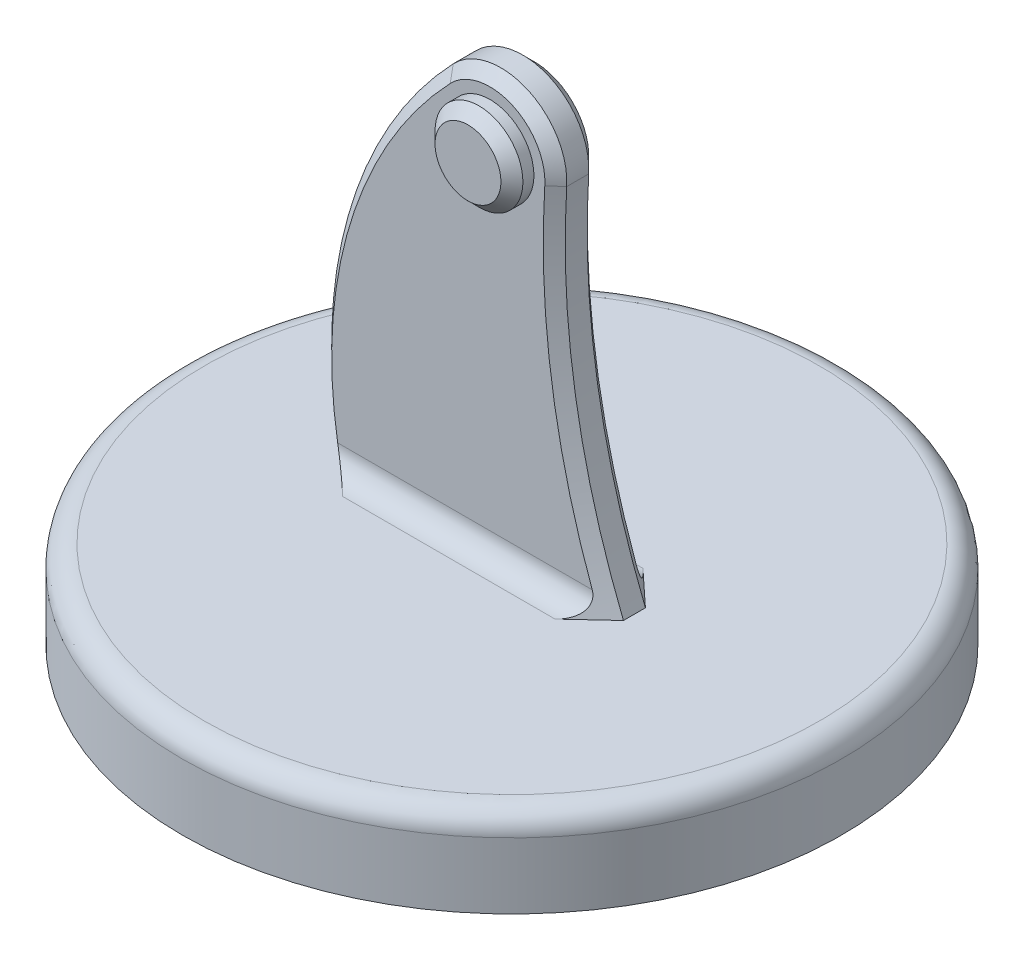
from build123d import *

# Parameters (mm, degrees)
IZIM1_R                     = 75
Y_KSEKLIK_EKSTR_ZYON1_DEPTH = 20
RADYUS1_R                   = 5
Y_KSEKLIK_EKSTR_ZYON2_DEPTH = 5
PAH1_SIZE                   = 2.5
RADYUS2_R                   = 5
IZIM3_R                     = 10
Y_KSEKLIK_EKSTR_ZYON3_DEPTH = 5
PAH2_SIZE                   = 2.5
IZIM4_R                     = 5
KES_EKSTR_ZYON1_DEPTH       = 10


with BuildPart() as part:
    # Çizim1 → Yükseklik-Ekstrüzyon1 (new body)
    with BuildSketch(Plane(origin=(0, 0, 0), x_dir=(1, 0, 0), z_dir=(0, 1, 0))):
        with Locations(Location((0, 0, 0), (0, 0, 270))):
            Circle(IZIM1_R)
    extrude(amount=Y_KSEKLIK_EKSTR_ZYON1_DEPTH)

    # Radyus1
    radyus1_edges = [part.edges().sort_by_distance(p)[0] for p in [
        (0, 20, -75),
    ]]
    fillet(radyus1_edges, radius=RADYUS1_R)

    # Çizim2 → Yükseklik-Ekstrüzyon2 (add, symmetric)
    with BuildSketch(Plane.XY):
        with BuildLine():
            Line((-35, 15), (30, 15))
            ThreePointArc((30, 15), (17.428098582, 56.126843631), (14.970645506, 99.06203778))
            ThreePointArc((14.970645506, 99.06203778), (6.012327577, 113.742340307), (-10.849201429, 110.358321696))
            ThreePointArc((-10.849201429, 110.358321696), (-35.460543036, 65.854059614), (-35, 15))
        make_face()
    extrude(amount=Y_KSEKLIK_EKSTR_ZYON2_DEPTH, both=True)

    # Pah1
    pah1_edges = [part.edges().sort_by_distance(p)[0] for p in [
        (16.970295051, 58.803839559, -5),
        (6.012327577, 113.742340307, -5),
        (-34.796467261, 68.341174934, 5),
        (16.970295051, 58.803839559, 5),
        (6.012327577, 113.742340307, 5),
        (-34.796467261, 68.341174934, -5),
    ]]
    chamfer(pah1_edges, length=PAH1_SIZE)

    # Radyus2
    radyus2_edges = [part.edges().sort_by_distance(p)[0] for p in [
        (-4.241511046, 20, -5),
        (-4.241511046, 20, 5),
    ]]
    fillet(radyus2_edges, radius=RADYUS2_R)

    # Çizim3 → Yükseklik-Ekstrüzyon3 (add)
    with BuildSketch(Plane.XY.offset(5)):
        with Locations(Location((0, 100, 0), (0, 0, 180))):
            Circle(IZIM3_R)
    extrude(amount=Y_KSEKLIK_EKSTR_ZYON3_DEPTH)

    # Pah2
    pah2_edges = [part.edges().sort_by_distance(p)[0] for p in [
        (10, 100, 10),
    ]]
    chamfer(pah2_edges, length=PAH2_SIZE)

    # Çizim4 → Kes-Ekstrüzyon1 (cut)
    with BuildSketch(Plane(origin=(0, 0, -5), x_dir=(-1, 0, 0), z_dir=(0, 0, -1))):
        with Locations((0, 100)):
            Circle(IZIM4_R)
    extrude(amount=-KES_EKSTR_ZYON1_DEPTH, mode=Mode.SUBTRACT)


solid = part.part
